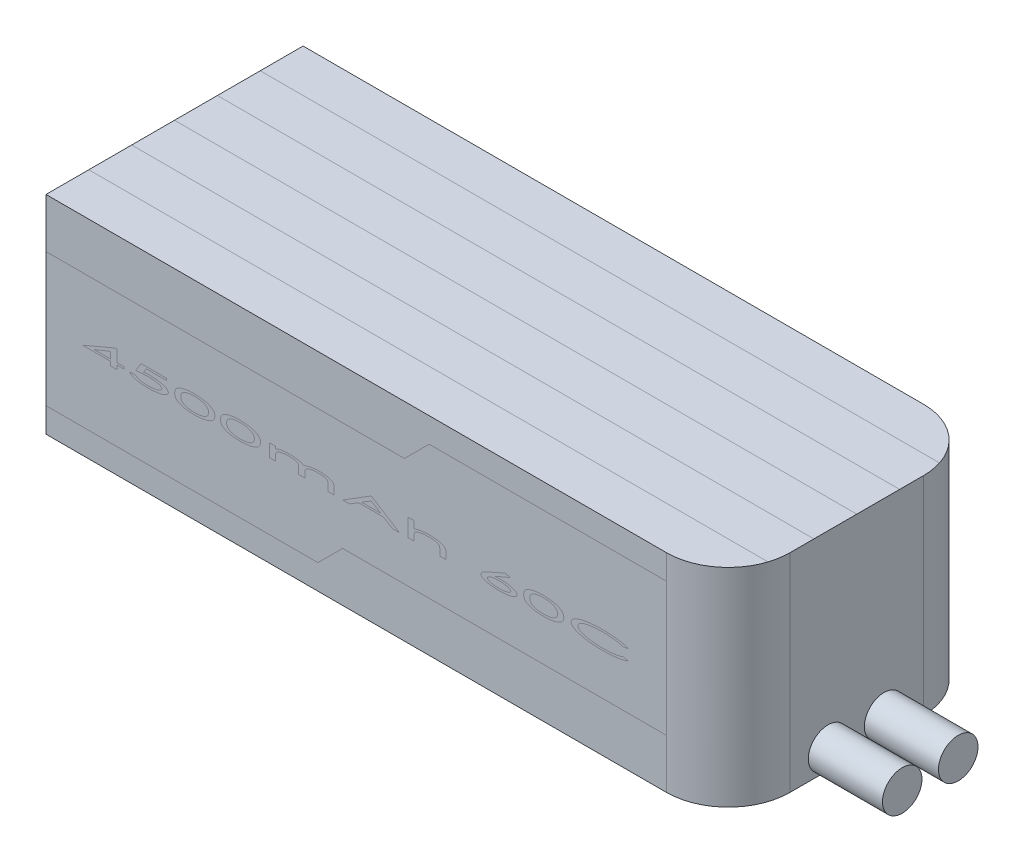
from build123d import *

# Parameters (mm, degrees)
SALIENTE_EXTRUIR1_DEPTH = 42
CROQUIS7_R              = 4
SALIENTE_EXTRUIR2_DEPTH = 15


with BuildPart() as part:
    # Croquis1 → Saliente-Extruir1 (new body)
    with BuildSketch(Plane(origin=(0, 0, 0), x_dir=(1, 0, 0), z_dir=(0, 1, 0))):
        with BuildLine():
            Line((0, 0), (125.5, 0))
            ThreePointArc((125.5, 0), (134.338834765, 3.661165235), (138, 12.5))
            Line((138, 12.5), (138, 39.5))
            ThreePointArc((138, 39.5), (134.338834765, 48.338834765), (125.5, 52))
            Line((125.5, 52), (0, 52))
            Line((0, 52), (0, 0))
        make_face()
    extrude(amount=SALIENTE_EXTRUIR1_DEPTH)

    # Croquis7 → Saliente-Extruir2 (add)
    with BuildSketch(Plane(origin=(138, 0, 0), x_dir=(0, 0, -1), z_dir=(1, 0, 0))):
        with Locations((20.189152703, 4)):
            Circle(CROQUIS7_R)
        with Locations((31.517370161, 4)):
            Circle(CROQUIS7_R)
    extrude(amount=SALIENTE_EXTRUIR2_DEPTH)


solid = part.part
